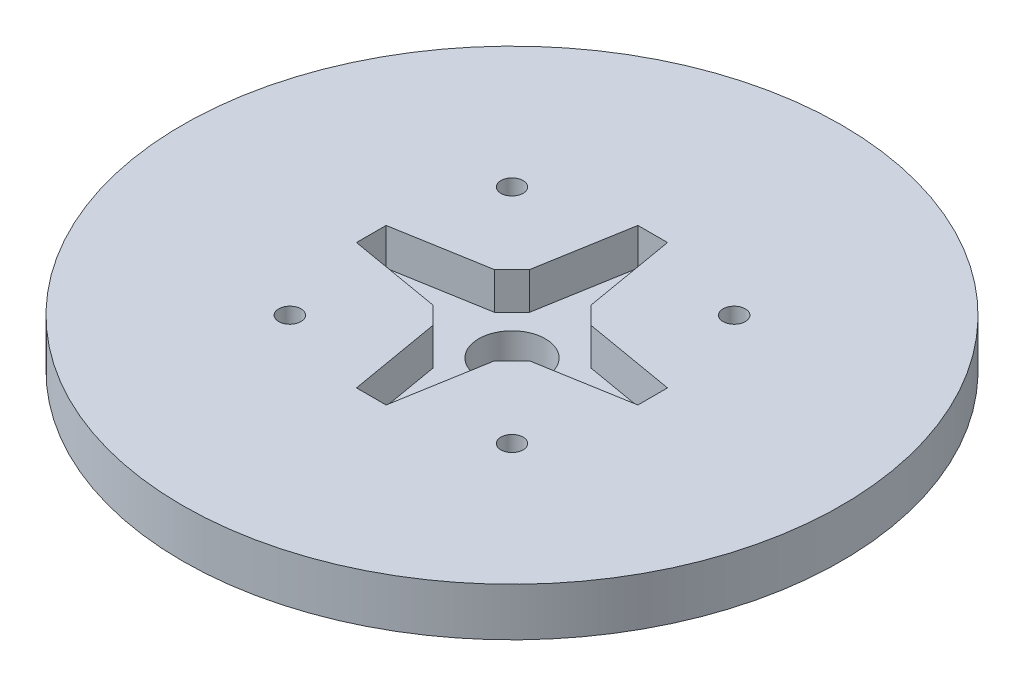
from build123d import *

# Parameters (mm, degrees)
SKETCH1_R           = 44.5
BOSS_EXTRUDE1_DEPTH = 6.5
SKETCH2_R           = 32.5
BOSS_EXTRUDE2_DEPTH = 8
SKETCH3_R           = 1.5
CUT_EXTRUDE1_DEPTH  = 30
CUT_EXTRUDE2_DEPTH  = 5
SKETCH5_R           = 4.5
CUT_EXTRUDE3_DEPTH  = 9
CUT_EXTRUDE4_DEPTH  = 5


with BuildPart() as part:
    # Sketch1 → Boss-Extrude1 (new body)
    with BuildSketch(Plane(origin=(0, 0, 0), x_dir=(1, 0, 0), z_dir=(0, 1, 0))):
        with Locations(Location((0, 0, 0), (0, 0, 90))):
            Circle(SKETCH1_R)
    extrude(amount=BOSS_EXTRUDE1_DEPTH)

    # Sketch2 → Boss-Extrude2 (add)
    with BuildSketch(Plane(origin=(0, 0, 0), x_dir=(1, 0, 0), z_dir=(0, 1, 0))):
        with Locations(Location((0, 0, 0), (0, 0, 270))):
            Circle(SKETCH2_R)
    extrude(amount=-BOSS_EXTRUDE2_DEPTH)

    # Sketch3 → Cut-Extrude1 (cut, symmetric)
    with BuildSketch(Plane(origin=(0, 0, 0), x_dir=(1, 0, 0), z_dir=(0, 1, 0))):
        with Locations(Location((-15, 15, 0), (0, 0, 270))):
            Circle(SKETCH3_R)
        with Locations(Location((15, 15, 0), (0, 0, 270))):
            Circle(SKETCH3_R)
        with Locations(Location((15, -15, 0), (0, 0, 270))):
            Circle(SKETCH3_R)
        with Locations(Location((-15, -15, 0), (0, 0, 270))):
            Circle(SKETCH3_R)
    extrude(amount=CUT_EXTRUDE1_DEPTH, both=True, mode=Mode.SUBTRACT)

    # Sketch4 → Cut-Extrude2 (cut)
    with BuildSketch(Plane(origin=(0, 6.5, 0), x_dir=(1, 0, 0), z_dir=(0, 1, 0))):
        Polygon((-2, 19), (2, 19), (4.5, 4.5), (19, 2), (19, -2), (4.5, -4.5), (2, -19), (-2, -19), (-4.5, -4.5), (-19, -2), (-19, 2), (-4.5, 4.5), align=None)
    extrude(amount=-CUT_EXTRUDE2_DEPTH, mode=Mode.SUBTRACT)

    # Sketch5 → Cut-Extrude3 (cut)
    with BuildSketch(Plane(origin=(0, 6.5, 0), x_dir=(1, 0, 0), z_dir=(0, 1, 0))):
        with Locations(Location((0, 0, 0), (0, 0, 270))):
            Circle(SKETCH5_R)
    extrude(amount=-CUT_EXTRUDE3_DEPTH, mode=Mode.SUBTRACT)

    # Sketch6 → Cut-Extrude4 (cut)
    with BuildSketch(Plane(origin=(0, 6.5, 0), x_dir=(1, 0, 0), z_dir=(0, 1, 0))):
        Polygon((-6.5, -4.155172414), (-6.5, 4.155172414), (-4.155172414, 6.5), (4.155172414, 6.5), (6.5, 4.155172414), (6.5, -4.155172414), (4.155172414, -6.5), (-4.155172414, -6.5), align=None)
    extrude(amount=-CUT_EXTRUDE4_DEPTH, mode=Mode.SUBTRACT)


solid = part.part
